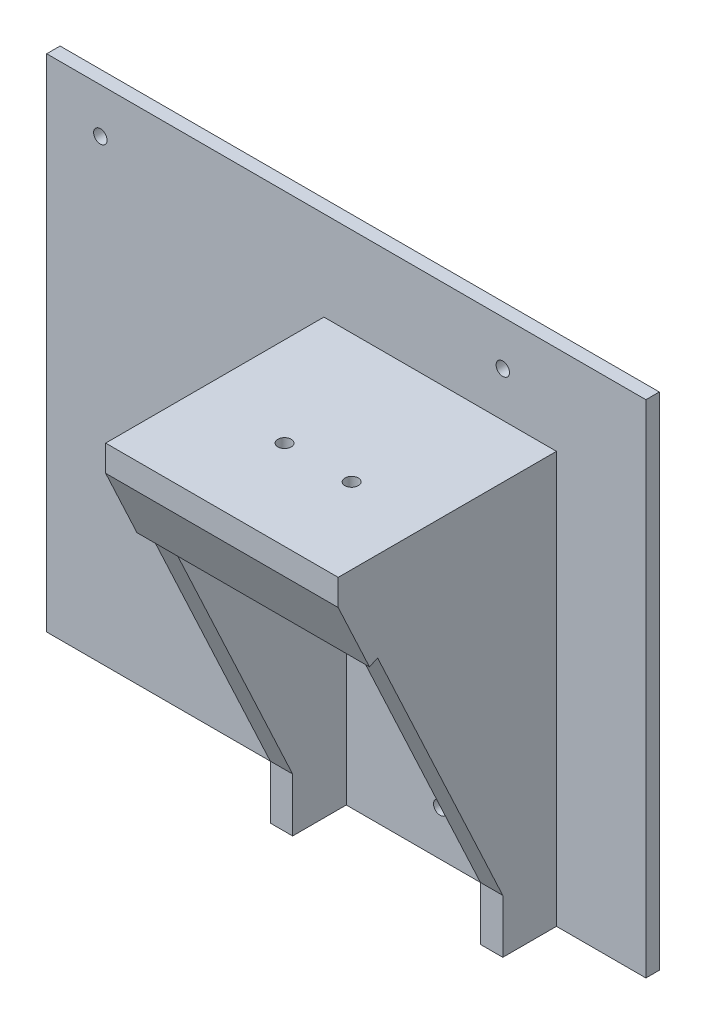
from build123d import *

# Parameters (mm, degrees)
SKETCH1_W           = 72
SKETCH1_H           = 92
BOSS_EXTRUDE1_DEPTH = 3
SKETCH2_W           = 5
SKETCH2_H           = 92
BOSS_EXTRUDE2_DEPTH = 47
BOSS_EXTRUDE3_REACH = 78.89
SKETCH3_W           = 52
SKETCH3_H           = 20
CUT_EXTRUDE3_REACH  = 87.557
SKETCH8_W           = 52
SKETCH8_H           = 16.552945357
BOSS_EXTRUDE5_DEPTH = 2
SKETCH9_W           = 52
SKETCH9_H           = 5
SKETCH9_H_2         = 0.845770931
BOSS_EXTRUDE6_DEPTH = 1.812366
SKETCH10_W          = 42
SKETCH10_H          = 40
CUT_EXTRUDE4_DEPTH  = 17
CUT_EXTRUDE5_REACH  = 113.555
SKETCH12_R          = 1.5
SKETCH13_W          = 72
SKETCH13_H          = 3
BOSS_EXTRUDE7_DEPTH = 20
SKETCH15_W          = 3
SKETCH15_H          = 112
BOSS_EXTRUDE8_DEPTH = 20
SKETCH16_W          = 3
SKETCH16_H          = 112
BOSS_EXTRUDE9_DEPTH = 42
CUT_EXTRUDE9_REACH  = 115.237
SKETCH14_R          = 1.5


with BuildPart() as part:
    # Sketch1 → Boss-Extrude1 (new body)
    with BuildSketch(Plane.XY):
        Rectangle(SKETCH1_W, SKETCH1_H)
    extrude(amount=BOSS_EXTRUDE1_DEPTH)

    # Sketch2 → Boss-Extrude2 (add)
    with BuildSketch(Plane.XY.offset(3)):
        with Locations((33.5, 0)):
            Rectangle(SKETCH2_W, SKETCH2_H)
        with Locations((-13.5, 0)):
            Rectangle(SKETCH2_W, SKETCH2_H)
    extrude(amount=BOSS_EXTRUDE2_DEPTH)

    # Sketch3 → Boss-Extrude3 (add, up to next)
    with BuildSketch(Plane.XY.offset(50), mode=Mode.PRIVATE) as boss_extrude3_sk1:
        with Locations((10, 36)):
            Rectangle(SKETCH3_W, SKETCH3_H)
    boss_extrude3_tool1 = extrude(boss_extrude3_sk1.sketch, amount=-BOSS_EXTRUDE3_REACH, mode=Mode.PRIVATE) - part.part
    add(boss_extrude3_tool1.solids().sort_by_distance((10, 36, 50))[0])

    # Sketch7 → Cut-Extrude3 (cut, up to next)
    with BuildSketch(Plane.ZY.offset(16), mode=Mode.PRIVATE) as cut_extrude3_sk1:
        Polygon((50, 41), (15, -34), (15, -46), (50, -46), align=None)
    cut_extrude3_tool1 = extrude(cut_extrude3_sk1.sketch, amount=-CUT_EXTRUDE3_REACH, mode=Mode.PRIVATE) & part.part
    add(cut_extrude3_tool1.solids().sort_by_distance((-16, -16.515152, 36.919192))[0], mode=Mode.SUBTRACT)

    # Sketch8 → Boss-Extrude5 (add)
    with BuildSketch(Plane(origin=(0, -11.828467153, 25.346715328), x_dir=(1, 0, 0), z_dir=(0, -0.42288546533112387, 0.9061831399952655))):
        with Locations((10, 50.021309328)):
            Rectangle(SKETCH8_W, SKETCH8_H)
    extrude(amount=BOSS_EXTRUDE5_DEPTH)

    # Sketch9 → Boss-Extrude6 (add)
    with BuildSketch(Plane.XY.offset(50)):
        with Locations((10, 43.5)):
            Rectangle(SKETCH9_W, SKETCH9_H)
        with Locations((10, 40.577114534)):
            Rectangle(SKETCH9_W, SKETCH9_H_2)
    extrude(amount=BOSS_EXTRUDE6_DEPTH)

    # Sketch10 → Cut-Extrude4 (cut)
    with BuildSketch(Plane.XZ.offset(-26)):
        with Locations((10, 23)):
            Rectangle(SKETCH10_W, SKETCH10_H)
    extrude(amount=-CUT_EXTRUDE4_DEPTH, mode=Mode.SUBTRACT)

    # Sketch12 → Cut-Extrude5 (cut, up to next)
    with BuildSketch(Plane(origin=(0, 46, 0), x_dir=(1, 0, 0), z_dir=(0, 1, 0)), mode=Mode.PRIVATE) as cut_extrude5_sk1:
        with Locations(Location((4, -31.81236628, 0), (0, 0, 270))):
            Circle(SKETCH12_R)
    cut_extrude5_tool1 = extrude(cut_extrude5_sk1.sketch, amount=-CUT_EXTRUDE5_REACH, mode=Mode.PRIVATE) & part.part
    # Sketch12 → Cut-Extrude5 (cut, up to next)
    with BuildSketch(Plane(origin=(0, 46, 0), x_dir=(1, 0, 0), z_dir=(0, 1, 0)), mode=Mode.PRIVATE) as cut_extrude5_sk2:
        with Locations(Location((19, -31.81236628, 0), (0, 0, 270))):
            Circle(SKETCH12_R)
    cut_extrude5_tool2 = extrude(cut_extrude5_sk2.sketch, amount=-CUT_EXTRUDE5_REACH, mode=Mode.PRIVATE) & part.part
    add(cut_extrude5_tool1.solids().sort_by_distance((4, 46, 31.812366))[0], mode=Mode.SUBTRACT)
    add(cut_extrude5_tool2.solids().sort_by_distance((19, 46, 31.812366))[0], mode=Mode.SUBTRACT)

    # Sketch13 → Boss-Extrude7 (add)
    with BuildSketch(Plane(origin=(0, 46, 0), x_dir=(1, 0, 0), z_dir=(0, 1, 0))):
        with Locations((0, -1.5)):
            Rectangle(SKETCH13_W, SKETCH13_H)
    extrude(amount=BOSS_EXTRUDE7_DEPTH)

    # Sketch15 → Boss-Extrude8 (add)
    with BuildSketch(Plane(origin=(36, 0, 0), x_dir=(0, 0, -1), z_dir=(1, 0, 0))):
        with Locations((-1.5, 10)):
            Rectangle(SKETCH15_W, SKETCH15_H)
    extrude(amount=BOSS_EXTRUDE8_DEPTH)

    # Sketch16 → Boss-Extrude9 (add)
    with BuildSketch(Plane.ZY.offset(36)):
        with Locations((1.5, 10)):
            Rectangle(SKETCH16_W, SKETCH16_H)
    extrude(amount=BOSS_EXTRUDE9_DEPTH)

    # Sketch14 → Cut-Extrude9 (cut, up to next)
    with BuildSketch(Plane.XY.offset(3), mode=Mode.PRIVATE) as cut_extrude9_sk1:
        with Locations((24, 56)):
            Circle(SKETCH14_R)
    cut_extrude9_tool1 = extrude(cut_extrude9_sk1.sketch, amount=-CUT_EXTRUDE9_REACH, mode=Mode.PRIVATE) & part.part
    # Sketch14 → Cut-Extrude9 (cut, up to next)
    with BuildSketch(Plane.XY.offset(3), mode=Mode.PRIVATE) as cut_extrude9_sk2:
        with Locations((10, -36)):
            Circle(SKETCH14_R)
    cut_extrude9_tool2 = extrude(cut_extrude9_sk2.sketch, amount=-CUT_EXTRUDE9_REACH, mode=Mode.PRIVATE) & part.part
    # Sketch14 → Cut-Extrude9 (cut, up to next)
    with BuildSketch(Plane.XY.offset(3), mode=Mode.PRIVATE) as cut_extrude9_sk3:
        with Locations((-66, 56)):
            Circle(SKETCH14_R)
    cut_extrude9_tool3 = extrude(cut_extrude9_sk3.sketch, amount=-CUT_EXTRUDE9_REACH, mode=Mode.PRIVATE) & part.part
    add(cut_extrude9_tool1.solids().sort_by_distance((24, 56, 3))[0], mode=Mode.SUBTRACT)
    add(cut_extrude9_tool2.solids().sort_by_distance((10, -36, 3))[0], mode=Mode.SUBTRACT)
    add(cut_extrude9_tool3.solids().sort_by_distance((-66, 56, 3))[0], mode=Mode.SUBTRACT)


solid = part.part
